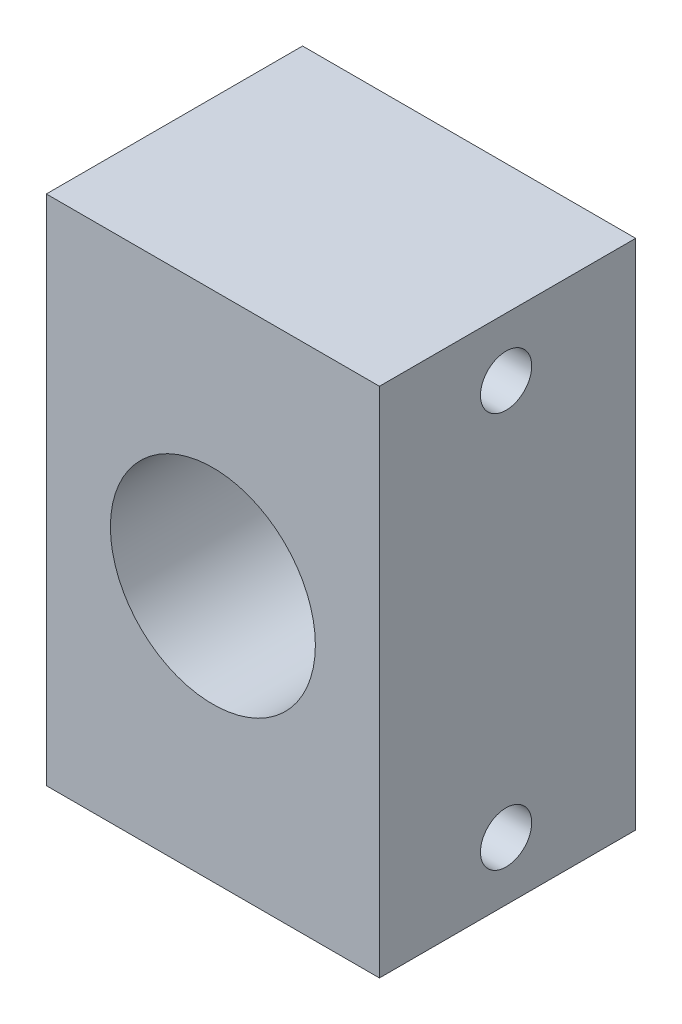
from build123d import *

# Parameters (mm, degrees)
SKETCH1_W           = 13
SKETCH1_H           = 20
SKETCH1_R           = 4
BOSS_EXTRUDE1_DEPTH = 10
SKETCH2_R           = 1
CUT_EXTRUDE1_DEPTH  = 20.209372712


with BuildPart() as part:
    # Sketch1 → Boss-Extrude1 (new body)
    with BuildSketch(Plane.XY):
        Rectangle(SKETCH1_W, SKETCH1_H)
        Circle(SKETCH1_R, mode=Mode.SUBTRACT)
    extrude(amount=BOSS_EXTRUDE1_DEPTH)

    # Sketch2 → Cut-Extrude1 (cut, through all)
    with BuildSketch(Plane(origin=(6.5, 0, 0), x_dir=(0, 0, -1), z_dir=(1, 0, 0))):
        with Locations((-5.057573934, 7.718180526)):
            Circle(SKETCH2_R)
    cut_extrude1 = extrude(amount=-CUT_EXTRUDE1_DEPTH, mode=Mode.SUBTRACT)

    # Mirror1: Cut-Extrude1 across plane
    add(cut_extrude1.mirror(Plane.ZX), mode=Mode.SUBTRACT)


solid = part.part
